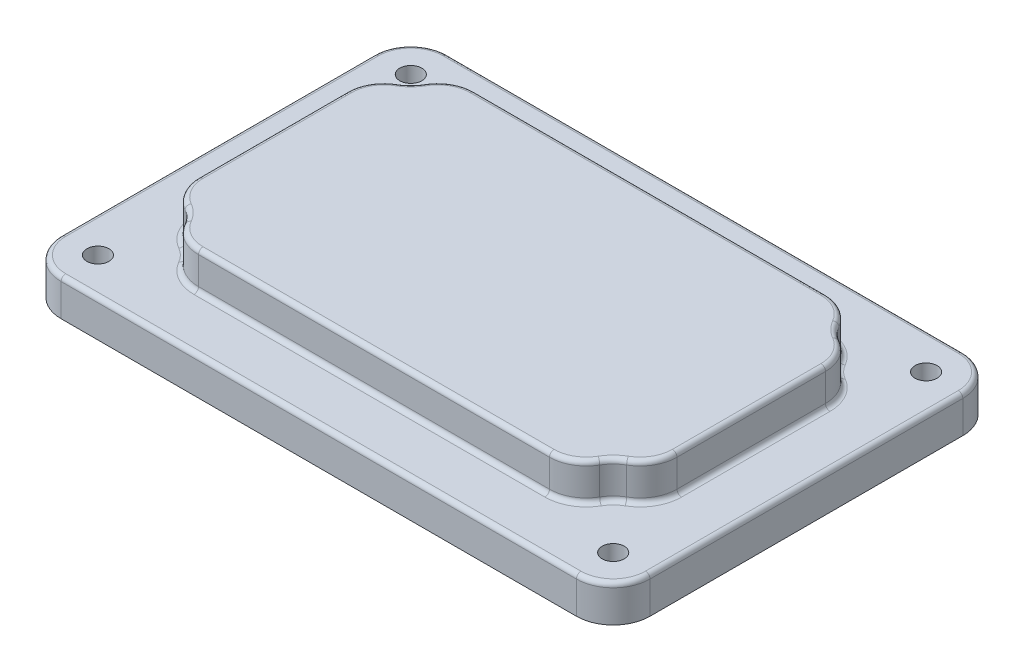
from build123d import *

# Parameters (mm, degrees)
BASE_DEPTH            = 6.35
SKETCH2_W             = 82.55
SKETCH2_H             = 47.625
TOP_BOSS_DEPTH        = 6.35
SKETCH3_R             = 6.35
CORNER_CUTS_DEPTH     = 6.35
FILLET1_R             = 6.35
SHELL1_T              = -3.175
SKETCH4_R             = 6.35
BOSS_EXTRUDE3_DEPTH   = 3.175
FILLET2_R             = 0.7874
FILLET3_R             = 0.7874
F_6_CLEARANCE_HOLE1_D = 3.7973


with BuildPart() as part:
    # Sketch1 → Base (new body)
    with BuildSketch(Plane(origin=(0, 0, 0), x_dir=(1, 0, 0), z_dir=(0, 1, 0))):
        with BuildLine():
            Line((-44.45, 33.3375), (44.45, 33.3375))
            ThreePointArc((44.45, 33.3375), (48.940128061, 31.477628061), (50.8, 26.9875))
            Line((50.8, 26.9875), (50.8, -26.9875))
            ThreePointArc((50.8, -26.9875), (48.940128061, -31.477628061), (44.45, -33.3375))
            Line((44.45, -33.3375), (-44.45, -33.3375))
            ThreePointArc((-44.45, -33.3375), (-48.940128061, -31.477628061), (-50.8, -26.9875))
            Line((-50.8, -26.9875), (-50.8, 26.9875))
            ThreePointArc((-50.8, 26.9875), (-48.940128061, 31.477628061), (-44.45, 33.3375))
        make_face()
    extrude(amount=BASE_DEPTH)

    # Sketch2 → Top Boss (add)
    with BuildSketch(Plane(origin=(0, 6.35, 0), x_dir=(1, 0, 0), z_dir=(0, 1, 0))):
        Rectangle(SKETCH2_W, SKETCH2_H)
    extrude(amount=TOP_BOSS_DEPTH)

    # Sketch3 → Corner Cuts (cut)
    with BuildSketch(Plane(origin=(0, 12.7, 0), x_dir=(1, 0, 0), z_dir=(0, 1, 0))):
        with Locations((41.275, 23.8125)):
            Circle(SKETCH3_R)
        with Locations((-41.275, 23.8125)):
            Circle(SKETCH3_R)
        with Locations((-41.275, -23.8125)):
            Circle(SKETCH3_R)
        with Locations((41.275, -23.8125)):
            Circle(SKETCH3_R)
    extrude(amount=-CORNER_CUTS_DEPTH, mode=Mode.SUBTRACT)

    # Fillet1
    fillet1_edges = [part.edges().sort_by_distance(p)[0] for p in [
        (41.275, 9.525, -17.4625),
        (34.925, 9.525, -23.8125),
        (-34.925, 9.525, -23.8125),
        (-41.275, 9.525, -17.4625),
        (-34.925, 9.525, 23.8125),
        (-41.275, 9.525, 17.4625),
        (34.925, 9.525, 23.8125),
        (41.275, 9.525, 17.4625),
    ]]
    fillet(fillet1_edges, radius=FILLET1_R)

    # Shell1
    shell1_openings = [part.faces().sort_by_distance(p)[0] for p in [
        (0, 0, 0),
    ]]
    offset(amount=SHELL1_T, openings=shell1_openings, kind=Kind.INTERSECTION)

    # Sketch4 → Boss-Extrude3 (add)
    with BuildSketch(Plane.XZ):
        with Locations((-44.45, 26.9875)):
            Circle(SKETCH4_R)
        with Locations((44.45, 26.9875)):
            Circle(SKETCH4_R)
        with Locations((44.45, -26.9875)):
            Circle(SKETCH4_R)
        with Locations((-44.45, -26.9875)):
            Circle(SKETCH4_R)
    extrude(amount=-BOSS_EXTRUDE3_DEPTH)

    # Fillet2
    fillet2_edges = [part.edges().sort_by_distance(p)[0] for p in [
        (48.940128061, 6.35, -31.477628061),
        (33.451477372, 6.35, 22.961761314),
        (40.424261314, 6.35, 15.988977372),
        (40.424261314, 6.35, -15.988977372),
        (33.451477372, 6.35, -22.961761314),
        (-33.451477372, 6.35, -22.961761314),
        (-40.424261314, 6.35, -15.988977372),
        (-40.424261314, 6.35, 15.988977372),
        (-33.451477372, 6.35, 22.961761314),
        (0, 6.35, -33.3375),
        (-48.940128061, 6.35, -31.477628061),
        (-50.8, 6.35, 0),
        (-48.940128061, 6.35, 31.477628061),
        (0, 6.35, 33.3375),
        (48.940128061, 6.35, 31.477628061),
        (50.8, 6.35, 0),
        (0, 12.7, 23.8125),
        (0, 6.35, 23.8125),
        (-36.784871939, 12.7, -19.322371939),
        (-41.275, 12.7, 0),
        (-36.784871939, 12.7, 19.322371939),
        (36.784871939, 12.7, 19.322371939),
        (41.275, 12.7, 0),
        (36.784871939, 12.7, -19.322371939),
        (0, 12.7, -23.8125),
        (-33.451477372, 12.7, 22.961761314),
        (-40.424261314, 12.7, 15.988977372),
        (-40.424261314, 12.7, -15.988977372),
        (-33.451477372, 12.7, -22.961761314),
        (33.451477372, 12.7, -22.961761314),
        (40.424261314, 12.7, -15.988977372),
        (40.424261314, 12.7, 15.988977372),
        (33.451477372, 12.7, 22.961761314),
        (36.784871939, 6.35, 19.322371939),
        (41.275, 6.35, 0),
        (36.784871939, 6.35, -19.322371939),
        (0, 6.35, -23.8125),
        (-36.784871939, 6.35, -19.322371939),
        (-41.275, 6.35, 0),
        (-36.784871939, 6.35, 19.322371939),
    ]]
    fillet(fillet2_edges, radius=FILLET2_R)

    # Fillet3
    fillet3_edges = [part.edges().sort_by_distance(p)[0] for p in [
        (-37.674630657, 3.175, -14.401477372),
        (-31.863977372, 3.175, -20.212130657),
        (31.863977372, 3.175, -20.212130657),
        (37.674630657, 3.175, -14.401477372),
        (37.674630657, 3.175, 14.401477372),
        (31.863977372, 3.175, 20.212130657),
        (-31.863977372, 3.175, 20.212130657),
        (-37.674630657, 3.175, 14.401477372),
        (0, 3.175, 20.6375),
        (38.1, 3.175, 0),
        (0, 3.175, -20.6375),
        (-38.1, 3.175, 0),
        (0, 9.525, 20.6375),
        (31.863977372, 9.525, 20.212130657),
        (37.674630657, 9.525, 14.401477372),
        (38.1, 9.525, 0),
        (37.674630657, 9.525, -14.401477372),
        (31.863977372, 9.525, -20.212130657),
        (0, 9.525, -20.6375),
        (-31.863977372, 9.525, -20.212130657),
        (-37.674630657, 9.525, -14.401477372),
        (-38.1, 9.525, 0),
        (-37.674630657, 9.525, 14.401477372),
        (-31.863977372, 9.525, 20.212130657),
        (34.539807909, 9.525, -17.077307909),
        (34.539807909, 3.175, -17.077307909),
        (34.539807909, 9.525, 17.077307909),
        (34.539807909, 3.175, 17.077307909),
        (-34.539807909, 9.525, 17.077307909),
        (-34.539807909, 3.175, 17.077307909),
        (-34.539807909, 9.525, -17.077307909),
        (-34.539807909, 3.175, -17.077307909),
        (0, 0, 30.1625),
        (0, 3.175, 30.1625),
        (-38.950738686, 1.5875, 30.1625),
        (-39.959871939, 0, 22.497371939),
        (-47.625, 1.5875, 21.488238686),
        (-39.959871939, 3.175, 22.497371939),
        (38.950738686, 1.5875, 30.1625),
        (47.625, 0, 0),
        (47.625, 3.175, 0),
        (39.959871939, 0, 22.497371939),
        (39.959871939, 3.175, 22.497371939),
        (47.625, 1.5875, 21.488238686),
        (0, 0, -30.1625),
        (0, 3.175, -30.1625),
        (38.950738686, 1.5875, -30.1625),
        (39.959871939, 0, -22.497371939),
        (47.625, 1.5875, -21.488238686),
        (39.959871939, 3.175, -22.497371939),
        (-47.625, 0, 0),
        (-47.625, 3.175, 0),
        (-47.625, 1.5875, -21.488238686),
        (-39.959871939, 0, -22.497371939),
        (-38.950738686, 1.5875, -30.1625),
        (-39.959871939, 3.175, -22.497371939),
    ]]
    fillet(fillet3_edges, radius=FILLET3_R)

    # #6 Clearance Hole1 (through all)
    with Locations(Plane(origin=(0, 6.35, 0), x_dir=(1, 0, 0), z_dir=(0, 1, 0))):
        with Locations((-44.45, 26.9875), (44.45, 26.9875), (44.45, -26.9875), (-44.45, -26.9875)):
            Hole(F_6_CLEARANCE_HOLE1_D / 2)


solid = part.part
